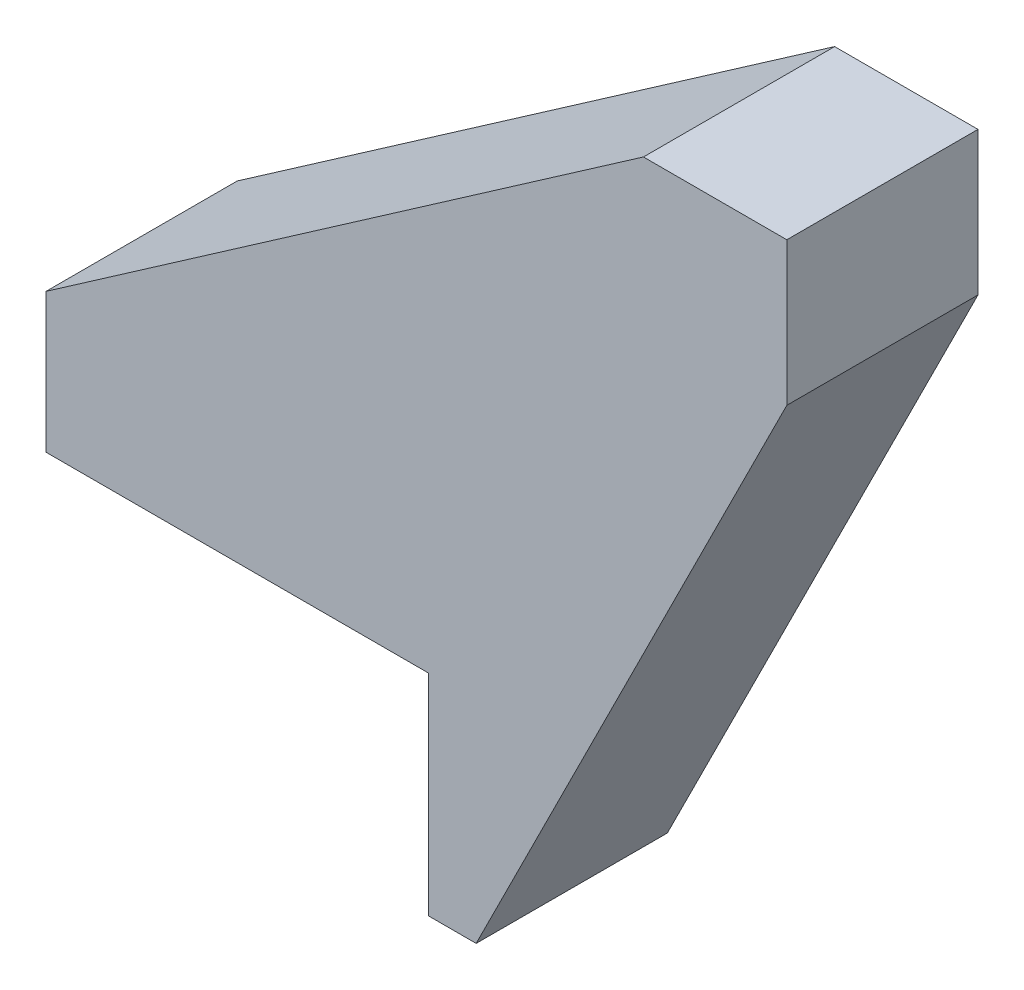
from build123d import *

# Parameters (mm, degrees)
BOSS_EXTRUDE1_DEPTH = 12.7


with BuildPart() as part:
    # Sketch1 → Boss-Extrude1 (new body)
    with BuildSketch(Plane.XY):
        Polygon((0, 0), (0, -13.97), (3.175, -13.97), (23.811795693, 27.305), (23.811795693, 36.83), (14.286795693, 36.83), (-25.4, 9.254811708), (-25.4, 0), align=None)
    extrude(amount=BOSS_EXTRUDE1_DEPTH)


solid = part.part
